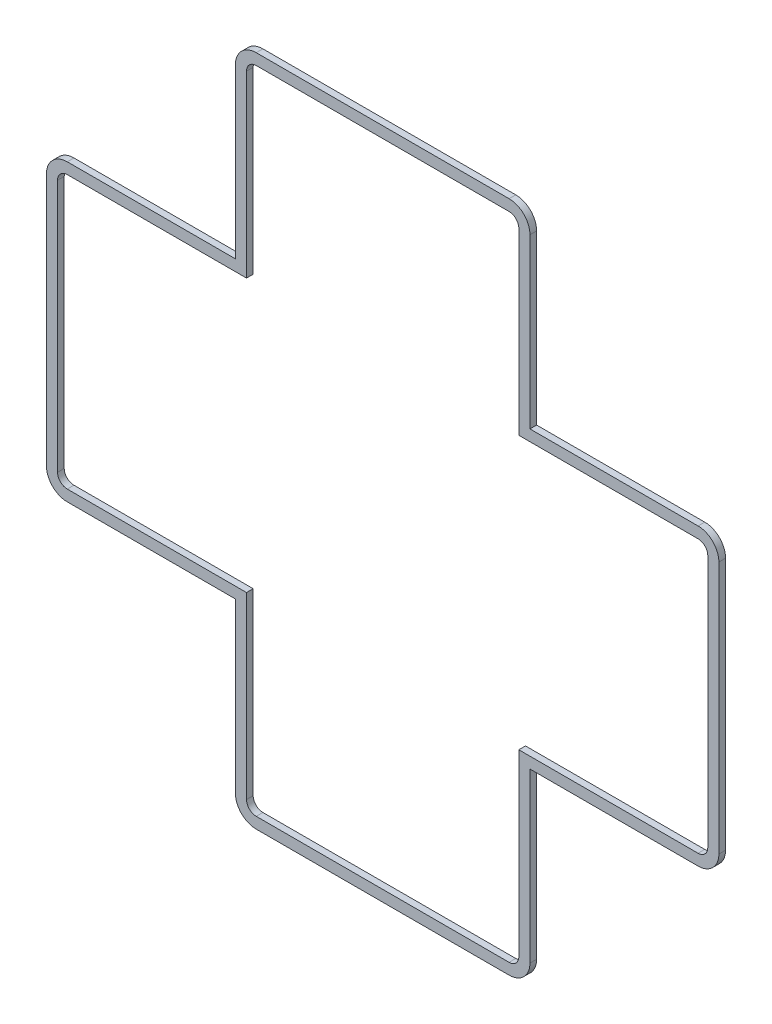
from build123d import *

# Parameters (mm, degrees)
SALIENTE_EXTRUIR1_DEPTH = 6


with BuildPart() as part:
    # Croquis1 → Saliente-Extruir1 (new body)
    with BuildSketch(Plane.XY):
        with BuildLine():
            Line((-283.764, 132.5), (-132.5, 132.5))
            Line((-132.5, 132.5), (-132.5, 283.764))
            ThreePointArc((-132.5, 283.764), (-127.012352652, 297.012352652), (-113.764, 302.5))
            Line((-113.764, 302.5), (113.764, 302.5))
            ThreePointArc((113.764, 302.5), (127.012352652, 297.012352652), (132.5, 283.764))
            Line((132.5, 283.764), (132.5, 132.5))
            Line((132.5, 132.5), (283.764, 132.5))
            ThreePointArc((283.764, 132.5), (297.012352652, 127.012352652), (302.5, 113.764))
            Line((302.5, 113.764), (302.5, -113.764))
            ThreePointArc((302.5, -113.764), (297.012352652, -127.012352652), (283.764, -132.5))
            Line((283.764, -132.5), (132.5, -132.5))
            Line((132.5, -132.5), (132.5, -283.764))
            ThreePointArc((132.5, -283.764), (127.012352652, -297.012352652), (113.764, -302.5))
            Line((113.764, -302.5), (-113.764, -302.5))
            ThreePointArc((-113.764, -302.5), (-127.012352652, -297.012352652), (-132.5, -283.764))
            Line((-132.5, -283.764), (-132.5, -132.5))
            Line((-132.5, -132.5), (-283.764, -132.5))
            ThreePointArc((-283.764, -132.5), (-297.012352652, -127.012352652), (-302.5, -113.764))
            Line((-302.5, -113.764), (-302.5, 113.764))
            ThreePointArc((-302.5, 113.764), (-297.012352652, 127.012352652), (-283.764, 132.5))
        make_face()
        with BuildLine():
            Line((-283.764, 122.5), (-122.5, 122.5))
            Line((-122.5, 122.5), (-122.5, 283.764))
            ThreePointArc((-122.5, 283.764), (-119.94128484, 289.94128484), (-113.764, 292.5))
            Line((-113.764, 292.5), (113.764, 292.5))
            ThreePointArc((113.764, 292.5), (119.94128484, 289.94128484), (122.5, 283.764))
            Line((122.5, 283.764), (122.5, 122.5))
            Line((122.5, 122.5), (283.764, 122.5))
            ThreePointArc((283.764, 122.5), (289.94128484, 119.94128484), (292.5, 113.764))
            Line((292.5, 113.764), (292.5, -113.764))
            ThreePointArc((292.5, -113.764), (289.94128484, -119.94128484), (283.764, -122.5))
            Line((283.764, -122.5), (122.5, -122.5))
            Line((122.5, -122.5), (122.5, -283.764))
            ThreePointArc((122.5, -283.764), (119.94128484, -289.94128484), (113.764, -292.5))
            Line((113.764, -292.5), (-113.764, -292.5))
            ThreePointArc((-113.764, -292.5), (-119.94128484, -289.94128484), (-122.5, -283.764))
            Line((-122.5, -283.764), (-122.5, -122.5))
            Line((-122.5, -122.5), (-283.764, -122.5))
            ThreePointArc((-283.764, -122.5), (-289.94128484, -119.94128484), (-292.5, -113.764))
            Line((-292.5, -113.764), (-292.5, 113.764))
            ThreePointArc((-292.5, 113.764), (-289.94128484, 119.94128484), (-283.764, 122.5))
        make_face(mode=Mode.SUBTRACT)
    extrude(amount=SALIENTE_EXTRUIR1_DEPTH)


solid = part.part
